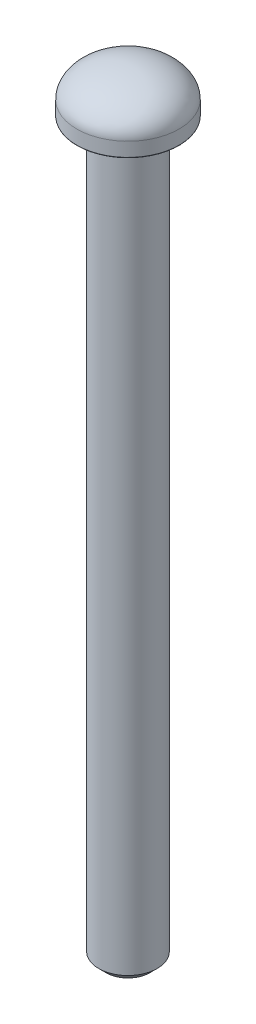
from build123d import *

# Parameters (mm, degrees)
SKETCH1_R           = 4
BOSS_EXTRUDE1_DEPTH = 100
SKETCH2_R           = 7
BOSS_EXTRUDE2_DEPTH = 2
DOME1_FACE_RADIUS   = 7
DOME1_HEIGHT        = 4
FILLET1_R           = 0.1
CHAMFER1_SIZE       = 1


with BuildPart() as part:
    # Sketch1 → Boss-Extrude1 (new body)
    with BuildSketch(Plane(origin=(0, 0, 0), x_dir=(1, 0, 0), z_dir=(0, 1, 0))):
        Circle(SKETCH1_R)
    extrude(amount=BOSS_EXTRUDE1_DEPTH)

    # Sketch2 → Boss-Extrude2 (add)
    with BuildSketch(Plane(origin=(0, 100, 0), x_dir=(1, 0, 0), z_dir=(0, 1, 0))):
        Circle(SKETCH2_R)
    extrude(amount=BOSS_EXTRUDE2_DEPTH)

    # Dome1: an elliptical dome of height H over a round flat face of radius A is half a spheroid: the quarter ellipse of half axes A and H revolved about the face's axis
    with BuildSketch(Plane((0, 102, 0), x_dir=(0, 0, -1), z_dir=(1, 0, 0)), mode=Mode.PRIVATE) as dome1_quarter:
        Ellipse(DOME1_FACE_RADIUS, DOME1_HEIGHT)
        Rectangle(DOME1_FACE_RADIUS, DOME1_HEIGHT, align=(Align.MIN, Align.MIN), mode=Mode.INTERSECT)
    revolve(dome1_quarter.sketch, axis=Axis((0, 102, 0), (0, 1, 0)))

    # Fillet1
    fillet1_edges = [part.edges().sort_by_distance(p)[0] for p in [
        (-7, 100, 0),
        (-4, 100, 0),
    ]]
    fillet(fillet1_edges, radius=FILLET1_R)

    # Chamfer1
    chamfer1_edges = [part.edges().sort_by_distance(p)[0] for p in [
        (-4, 0, 0),
    ]]
    chamfer(chamfer1_edges, length=CHAMFER1_SIZE)


solid = part.part
